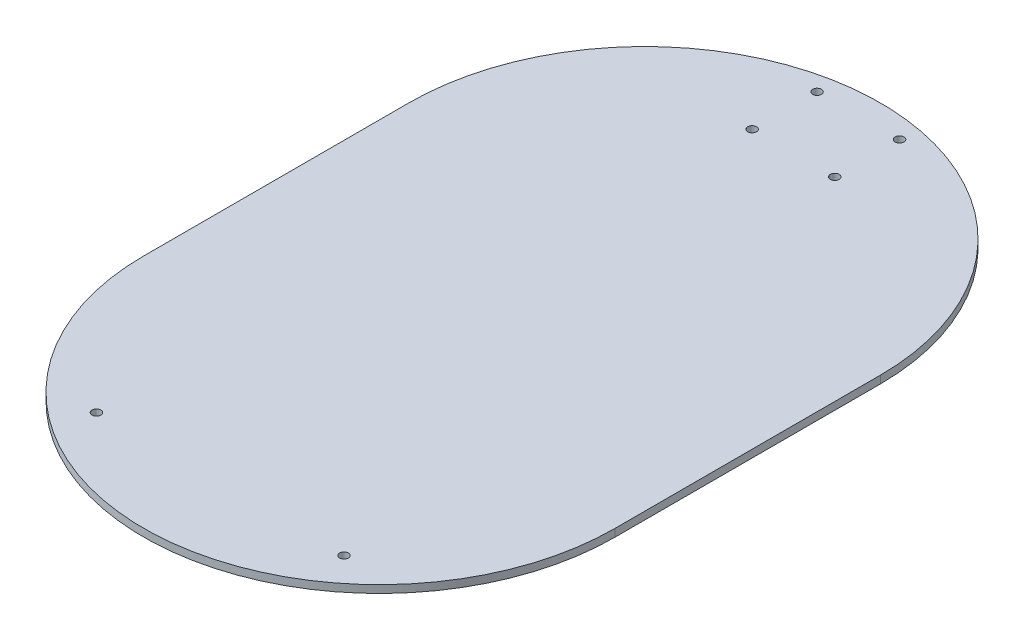
from build123d import *

# Parameters (mm, degrees)
SKETCH2_R           = 1.5
BOSS_EXTRUDE2_DEPTH = 2.6


with BuildPart() as part:
    # Sketch2 → Boss-Extrude2 (new body)
    with BuildSketch(Plane(origin=(0, 0, 0), x_dir=(1, 0, 0), z_dir=(0, 1, 0))):
        with BuildLine():
            Line((-80, -45), (-80, 45))
            ThreePointArc((-80, 45), (0, 125), (80, 45))
            Line((80, 45), (80, -45))
            ThreePointArc((80, -45), (0, -125), (-80, -45))
        make_face()
        with Locations(Location((14, 117.5, 0), (0, 0, 270))):
            Circle(SKETCH2_R, mode=Mode.SUBTRACT)
        with Locations(Location((14, 95.5, 0), (0, 0, 270))):
            Circle(SKETCH2_R, mode=Mode.SUBTRACT)
        with Locations(Location((-14, 95.5, 0), (0, 0, 270))):
            Circle(SKETCH2_R, mode=Mode.SUBTRACT)
        with Locations(Location((-14, 117.5, 0), (0, 0, 270))):
            Circle(SKETCH2_R, mode=Mode.SUBTRACT)
        with Locations(Location((42, -99, 0), (0, 0, 270))):
            Circle(SKETCH2_R, mode=Mode.SUBTRACT)
        with Locations(Location((-42, -99, 0), (0, 0, 270))):
            Circle(SKETCH2_R, mode=Mode.SUBTRACT)
    extrude(amount=BOSS_EXTRUDE2_DEPTH)


solid = part.part
